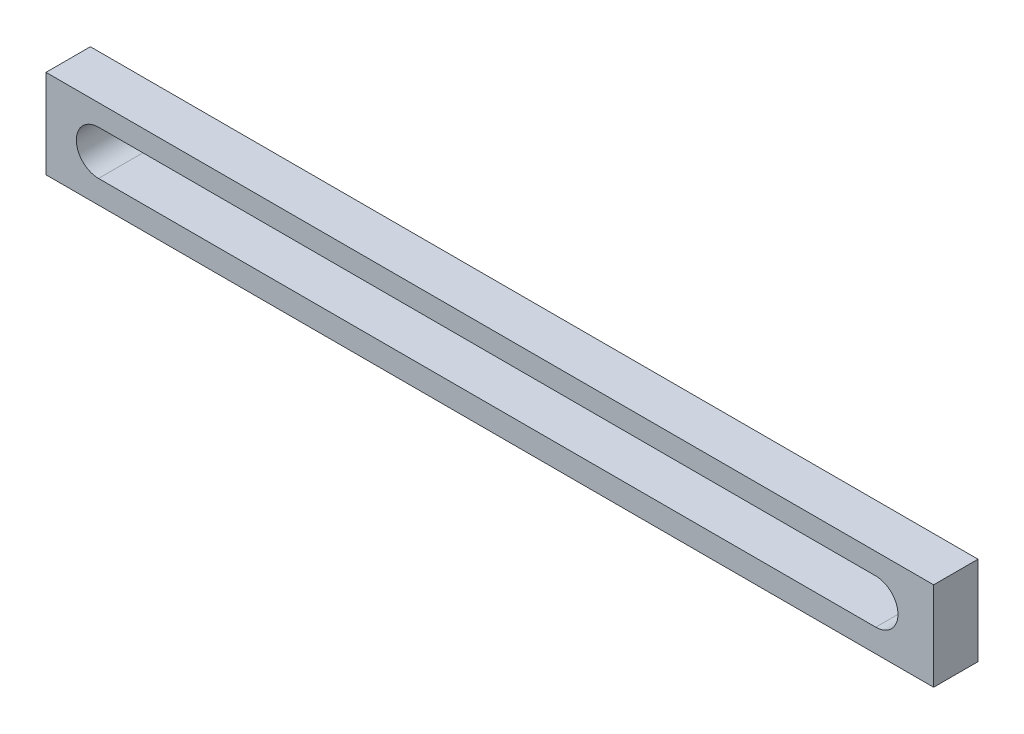
from build123d import *

# Parameters (mm, degrees)
SKETCH_1_W      = 100
SKETCH_1_H      = 10
EXTRUDE_1_DEPTH = 5


with BuildPart() as part:
    # 草图1 → 凸台-拉伸1 (new body)
    with BuildSketch(Plane.XY):
        with Locations((50, -5)):
            Rectangle(SKETCH_1_W, SKETCH_1_H)
        with BuildLine():
            Line((5.916428621, -2.393685736), (93.481950246, -2.393685736))
            ThreePointArc((93.481950246, -2.393685736), (95.981950246, -4.893685736), (93.481950246, -7.393685736))
            Line((93.481950246, -7.393685736), (5.916428621, -7.393685736))
            ThreePointArc((5.916428621, -7.393685736), (3.416428621, -4.893685736), (5.916428621, -2.393685736))
        make_face(mode=Mode.SUBTRACT)
    extrude(amount=EXTRUDE_1_DEPTH)


solid = part.part
